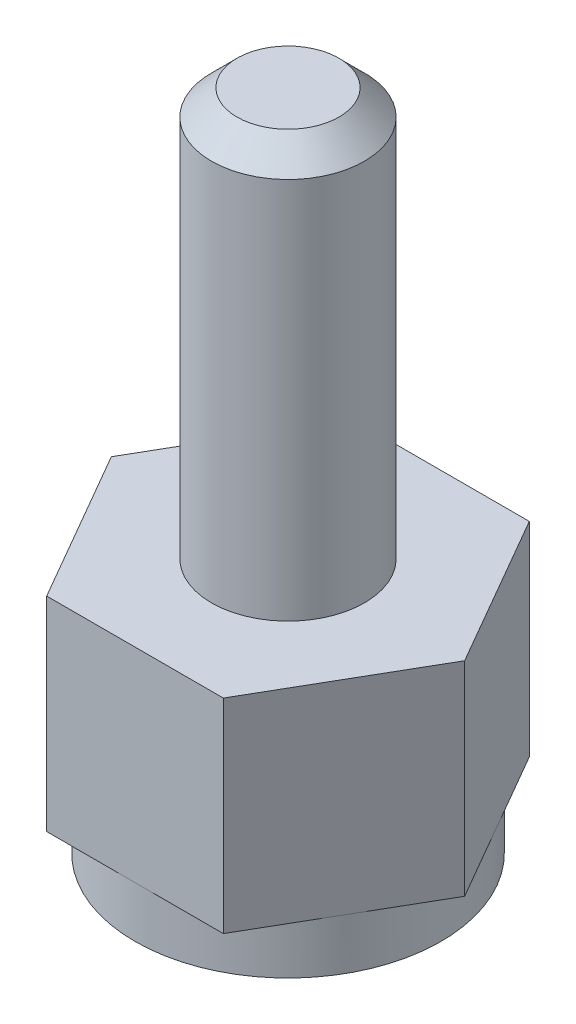
from build123d import *

# Parameters (mm, degrees)
SKETCH1_R           = 3
BOSS_EXTRUDE1_DEPTH = 1
BOSS_EXTRUDE2_DEPTH = 4
SKETCH3_R           = 1.5
BOSS_EXTRUDE3_DEPTH = 8
CHAMFER1_SIZE       = 0.5
SKETCH4_R           = 1.5
CUT_EXTRUDE1_DEPTH  = 3


with BuildPart() as part:
    # Sketch1 → Boss-Extrude1 (new body)
    with BuildSketch(Plane(origin=(0, 0, 0), x_dir=(1, 0, 0), z_dir=(0, 1, 0))):
        with Locations(Location((0, 0, 0), (0, 0, 270))):
            Circle(SKETCH1_R)
    extrude(amount=BOSS_EXTRUDE1_DEPTH)

    # Sketch2 → Boss-Extrude2 (add)
    with BuildSketch(Plane(origin=(0, 1, 0), x_dir=(1, 0, 0), z_dir=(0, 1, 0))):
        Polygon((3.464101615, 0), (1.732050808, 3), (-1.732050808, 3), (-3.464101615, 0), (-1.732050808, -3), (1.732050808, -3), align=None)
    extrude(amount=BOSS_EXTRUDE2_DEPTH)

    # Sketch3 → Boss-Extrude3 (add)
    with BuildSketch(Plane(origin=(0, 5, 0), x_dir=(1, 0, 0), z_dir=(0, 1, 0))):
        with Locations(Location((0, 0, 0), (0, 0, 270))):
            Circle(SKETCH3_R)
    extrude(amount=BOSS_EXTRUDE3_DEPTH)

    # Chamfer1
    chamfer1_edges = [part.edges().sort_by_distance(p)[0] for p in [
        (0, 13, -1.5),
    ]]
    chamfer(chamfer1_edges, length=CHAMFER1_SIZE)

    # Sketch4 → Cut-Extrude1 (cut)
    with BuildSketch(Plane.XZ):
        with Locations(Location((0, 0, 0), (0, 0, 90))):
            Circle(SKETCH4_R)
    extrude(amount=-CUT_EXTRUDE1_DEPTH, mode=Mode.SUBTRACT)


solid = part.part
